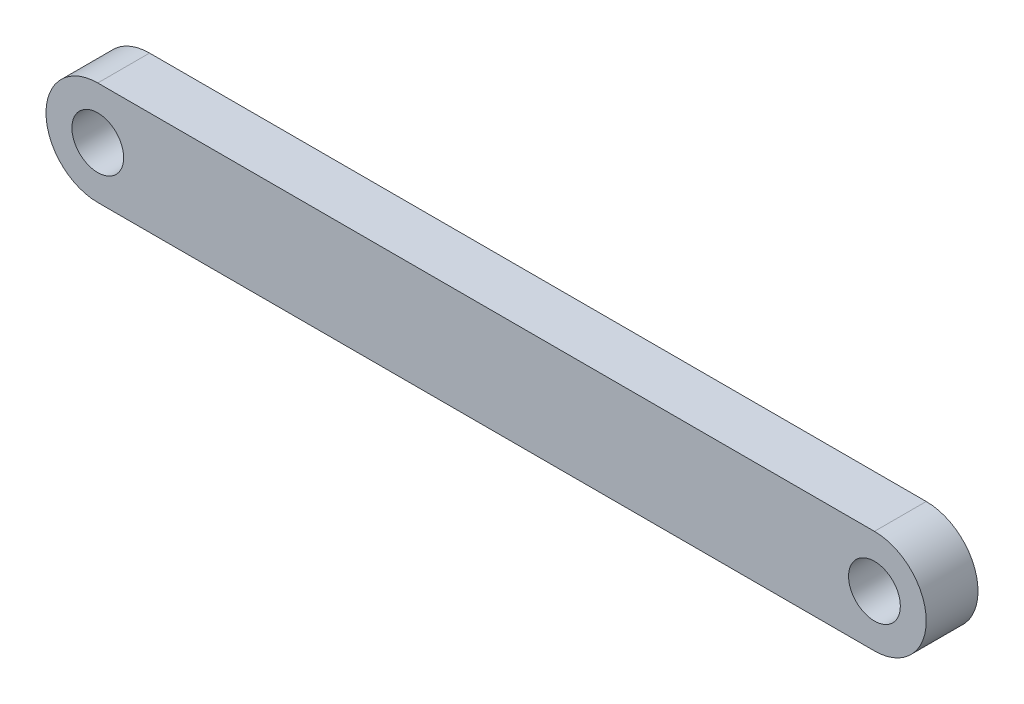
from build123d import *

# Parameters (mm, degrees)
SKETCH1_R           = 5
BOSS_EXTRUDE3_DEPTH = 10


with BuildPart() as part:
    # Sketch1 → Boss-Extrude3 (new body)
    with BuildSketch(Plane.XY):
        with BuildLine():
            Line((-75, 10), (75, 10))
            ThreePointArc((75, 10), (85, 0), (75, -10))
            Line((75, -10), (-75, -10))
            ThreePointArc((-75, -10), (-85, 0), (-75, 10))
        make_face()
        with Locations((-75, 0)):
            Circle(SKETCH1_R, mode=Mode.SUBTRACT)
        with Locations((75, 0)):
            Circle(SKETCH1_R, mode=Mode.SUBTRACT)
    extrude(amount=BOSS_EXTRUDE3_DEPTH)


solid = part.part
